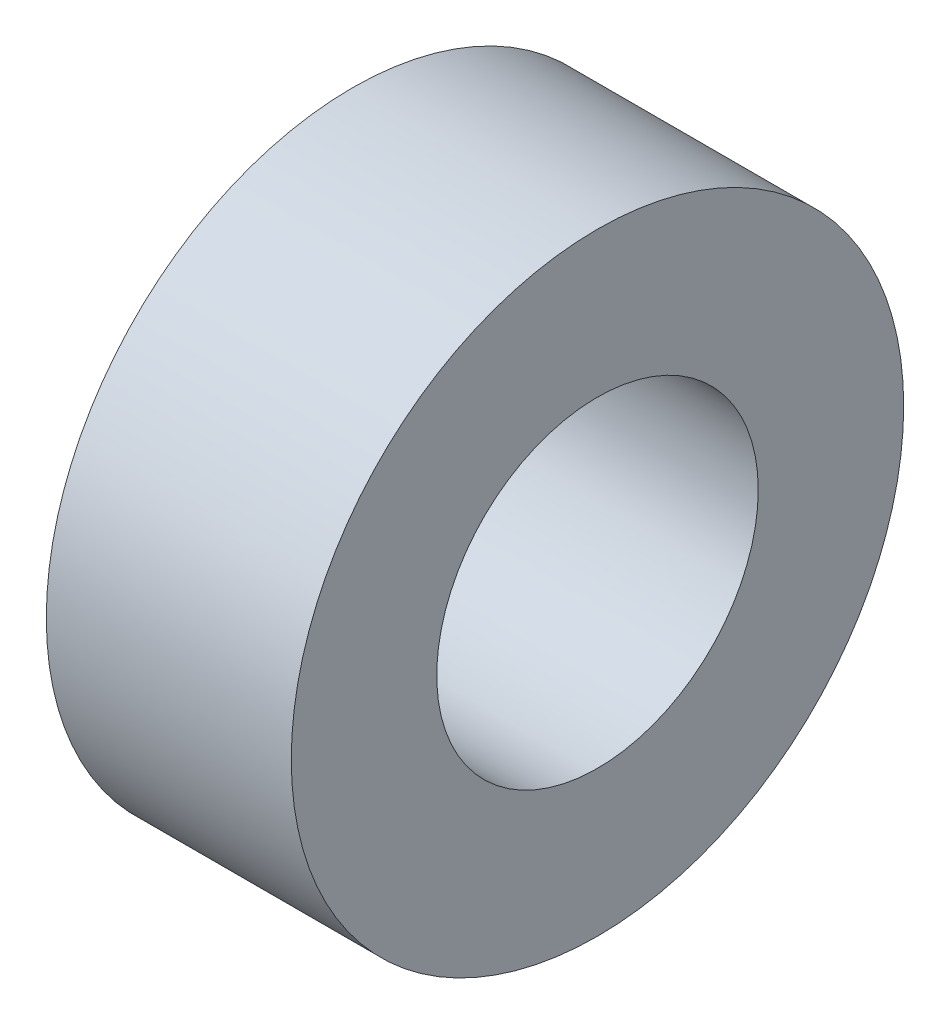
from build123d import *

# Parameters (mm, degrees)
ESQUISSE1_W             = 8
ESQUISSE1_H             = 10
ESQUISSE2_R             = 5.25
ENL_V_MAT_EXTRU_1_DEPTH = 10


with BuildPart() as part:
    # Esquisse1 → Révolution1 (revolve)
    with BuildSketch(Plane(origin=(0, 0, 0), x_dir=(1, 0, 0), z_dir=(0, 1, 0)), mode=Mode.PRIVATE) as r_volution1_sk:
        with Locations((4, 5)):
            Rectangle(ESQUISSE1_W, ESQUISSE1_H)
    revolve(r_volution1_sk.sketch.rotate(Axis((8, 0, -10), (-1, 0, 0)), 180), axis=Axis((8, 0, -10), (-1, 0, 0)))

    # Esquisse2 → Enlèv. mat.-Extru.1 (cut)
    with BuildSketch(Plane(origin=(8, 0, 0), x_dir=(0, 0, -1), z_dir=(1, 0, 0))):
        with Locations((10, 0)):
            Circle(ESQUISSE2_R)
    extrude(amount=-ENL_V_MAT_EXTRU_1_DEPTH, mode=Mode.SUBTRACT)


solid = part.part
